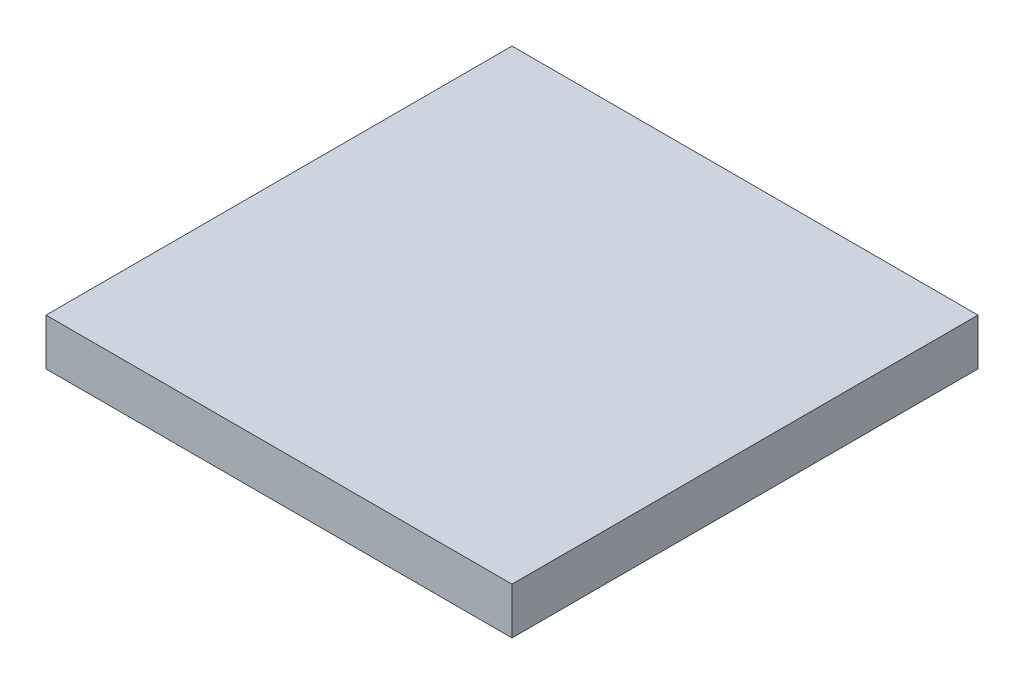
from build123d import *

# Parameters (mm, degrees)
SKETCH1_W           = 150
SKETCH1_H           = 150
BOSS_EXTRUDE1_DEPTH = 15


with BuildPart() as part:
    # Sketch1 → Boss-Extrude1 (new body)
    with BuildSketch(Plane(origin=(0, 0, 0), x_dir=(1, 0, 0), z_dir=(0, 1, 0))):
        Rectangle(SKETCH1_W, SKETCH1_H)
    extrude(amount=BOSS_EXTRUDE1_DEPTH)


solid = part.part
